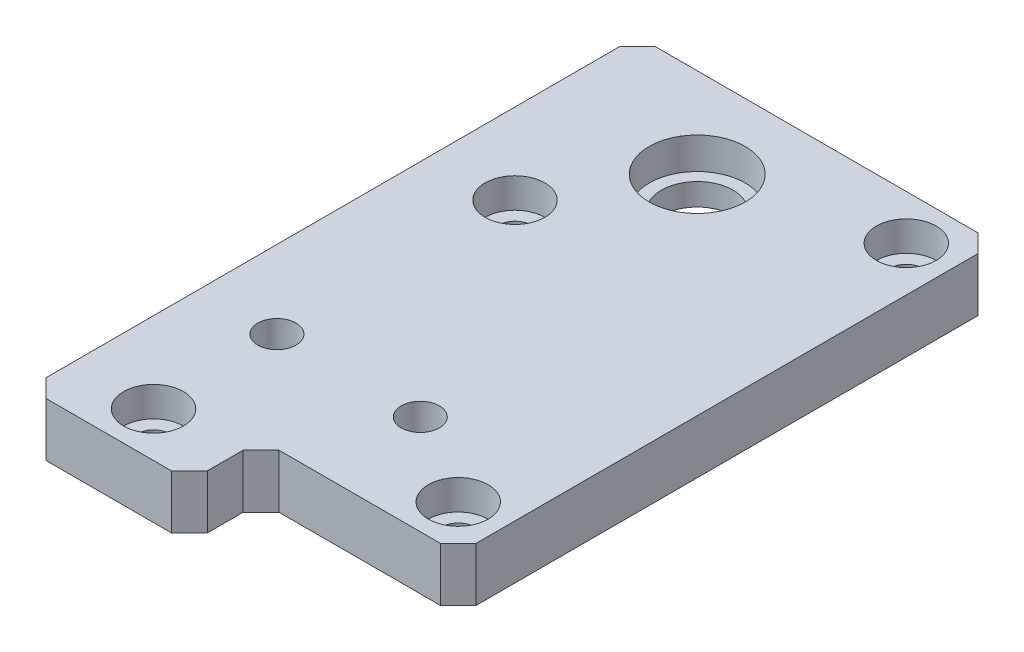
from build123d import *

# Parameters (mm, degrees)
BOSS_EXTRUDE1_DEPTH            = 9
CBORE_FOR_M5_SHCS1_D           = 5.5
CBORE_FOR_M5_SHCS1_CBORE_D     = 10
CBORE_FOR_M5_SHCS1_CBORE_DEPTH = 5
F_1_0MM_DOWEL_HOLE1_D          = 16.1
F_1_0MM_DOWEL_HOLE1_DEPTH      = 5.3
F_1_0MM_DOWEL_HOLE3_D          = 12
SKETCH14_R                     = 3.2
CUT_EXTRUDE1_DEPTH             = 68.490740106
CHAMFER1_SIZE                  = 3


with BuildPart() as part:
    # Sketch1 → Boss-Extrude1 (new body)
    with BuildSketch(Plane(origin=(0, 0, 0), x_dir=(1, 0, 0), z_dir=(0, 1, 0))):
        Polygon((2, -45), (35, -45), (35, 45), (-25, 45), (-25, -57), (2, -57), align=None)
    extrude(amount=BOSS_EXTRUDE1_DEPTH)

    # CBORE for M5 SHCS1 (through all)
    with Locations(Plane(origin=(0, 9, 0), x_dir=(1, 0, 0), z_dir=(0, 1, 0))):
        with Locations((27.5, 37.5), (27.5, -37.5), (-11.5, 11), (-11.5, -49.5)):
            CounterBoreHole(CBORE_FOR_M5_SHCS1_D / 2, CBORE_FOR_M5_SHCS1_CBORE_D / 2, CBORE_FOR_M5_SHCS1_CBORE_DEPTH)

    # Ø1.0mm Dowel Hole1
    with Locations(Plane(origin=(0, 9, 0), x_dir=(1, 0, 0), z_dir=(0, 1, 0))):
        with Locations((0, 30)):
            Hole(F_1_0MM_DOWEL_HOLE1_D / 2, depth=F_1_0MM_DOWEL_HOLE1_DEPTH)

    # Ø1.0mm Dowel Hole3 (through all)
    with Locations(Plane(origin=(0, 3.7, 0), x_dir=(1, 0, 0), z_dir=(0, 1, 0))):
        with Locations((0, 30)):
            Hole(F_1_0MM_DOWEL_HOLE3_D / 2)

    # Sketch14 → Cut-Extrude1 (cut, through all)
    with BuildSketch(Plane(origin=(0, 9, 0), x_dir=(1, 0, 0), z_dir=(0, 1, 0))):
        with Locations(Location((12, -28.35, 0), (0, 0, 270))):
            Circle(SKETCH14_R)
        with Locations(Location((-12, -28.35, 0), (0, 0, 270))):
            Circle(SKETCH14_R)
    extrude(amount=-CUT_EXTRUDE1_DEPTH, mode=Mode.SUBTRACT)

    # Chamfer1
    chamfer1_edges = [part.edges().sort_by_distance(p)[0] for p in [
        (35, 4.5, 45),
        (2, 4.5, 45),
        (2, 4.5, 57),
        (-25, 4.5, 57),
        (-25, 4.5, -45),
        (35, 4.5, -45),
    ]]
    chamfer(chamfer1_edges, length=CHAMFER1_SIZE)


solid = part.part
